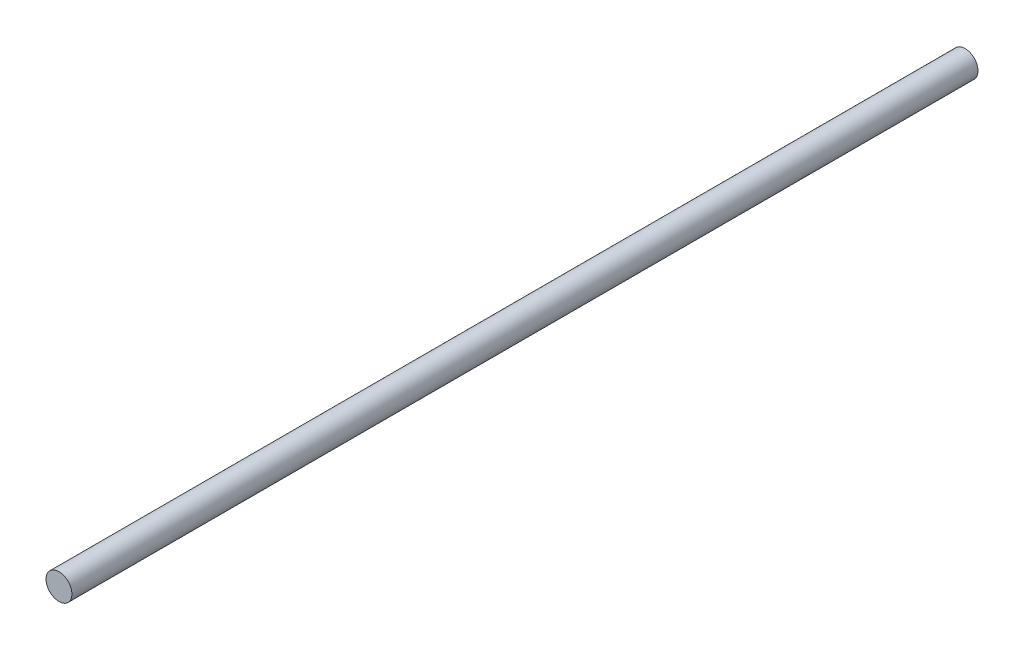
from build123d import *

# Parameters (mm, degrees)
SKETCH1_W = 2.54
SKETCH1_H = 177.8


with BuildPart() as part:
    # Sketch1 → Revolve-Thin1 (revolve)
    with BuildSketch(Plane(origin=(0, 0, 0), x_dir=(1, 0, 0), z_dir=(0, 1, 0)), mode=Mode.PRIVATE) as revolve_thin1_sk:
        with Locations((-1.743791677, 2.343903032)):
            Rectangle(SKETCH1_W, SKETCH1_H)
    revolve(revolve_thin1_sk.sketch.rotate(Axis((-3.013791677, 0, -91.243903032), (0, 0, 1)), 180), axis=Axis((-3.013791677, 0, -91.243903032), (0, 0, 1)))


solid = part.part
